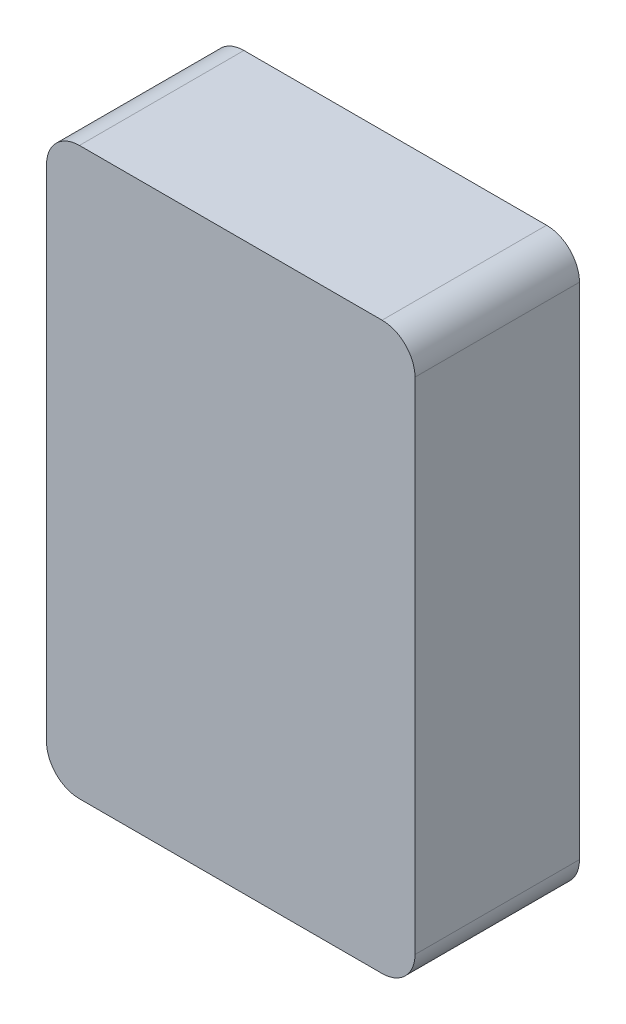
from build123d import *

# Parameters (mm, degrees)
BOSS_EXTRUDE1_DEPTH = 25


with BuildPart() as part:
    # Sketch1 → Boss-Extrude1 (new body)
    with BuildSketch(Plane.XY):
        with BuildLine():
            Line((-23, 43), (23, 43))
            ThreePointArc((23, 43), (26.535533906, 41.535533906), (28, 38))
            Line((28, 38), (28, -38))
            ThreePointArc((28, -38), (26.535533906, -41.535533906), (23, -43))
            Line((23, -43), (-23, -43))
            ThreePointArc((-23, -43), (-26.535533906, -41.535533906), (-28, -38))
            Line((-28, -38), (-28, 38))
            ThreePointArc((-28, 38), (-26.535533906, 41.535533906), (-23, 43))
        make_face()
    extrude(amount=BOSS_EXTRUDE1_DEPTH)


solid = part.part
